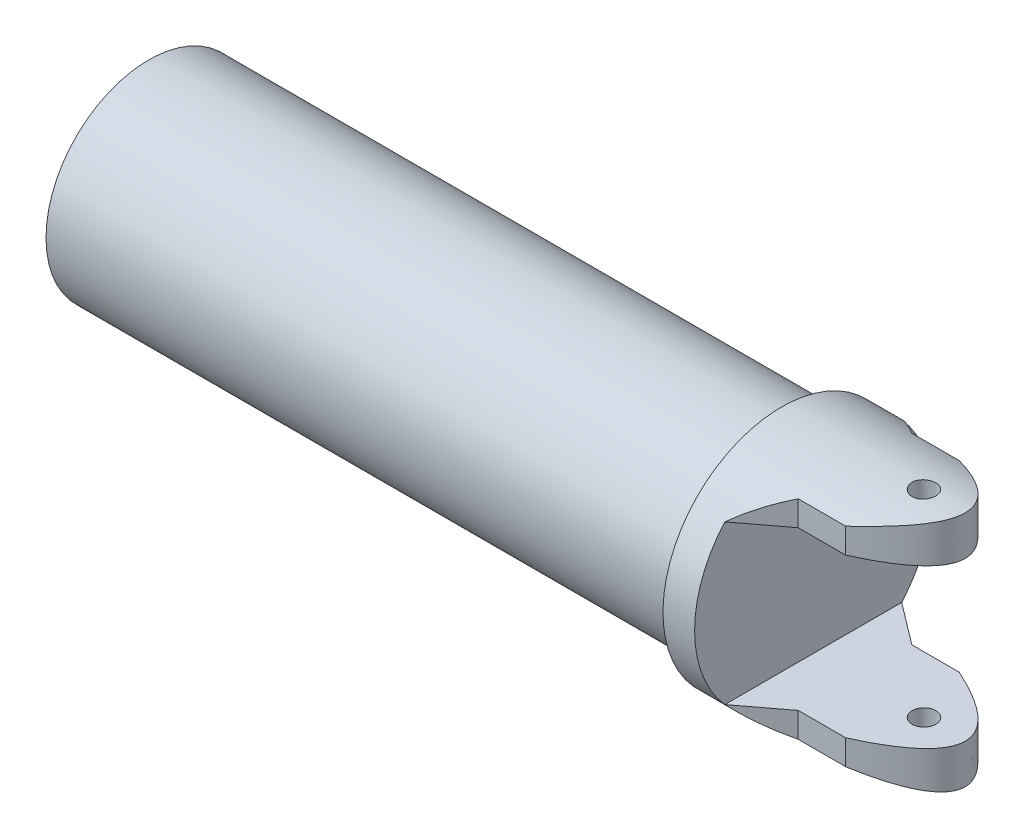
from build123d import *

# Parameters (mm, degrees)
SKETCH1_R               = 6.5
BOSS_EXTRUDE1_DEPTH     = 40
SKETCH2_R               = 7.5
BOSS_EXTRUDE2_DEPTH     = 2
BOSS_EXTRUDE3_DEPTH     = 10
CUT_EXTRUDE1_DEPTH      = 55.004629431
CUT_EXTRUDE1_DEPTH_BACK = 55.004629431
CUT_EXTRUDE2_DEPTH      = 54.619586107
CUT_EXTRUDE2_DEPTH_BACK = 54.619586107
SKETCH5_R               = 0.75
CUT_EXTRUDE3_DEPTH      = 30


with BuildPart() as part:
    # Sketch1 → Boss-Extrude1 (new body)
    with BuildSketch(Plane(origin=(0, 0, 0), x_dir=(0, 0, -1), z_dir=(1, 0, 0))):
        Circle(SKETCH1_R)
    extrude(amount=BOSS_EXTRUDE1_DEPTH)

    # Sketch2 → Boss-Extrude2 (add)
    with BuildSketch(Plane(origin=(40, 0, 0), x_dir=(0, 0, -1), z_dir=(1, 0, 0))):
        Circle(SKETCH2_R)
    extrude(amount=BOSS_EXTRUDE2_DEPTH)

    # Sketch3 → Boss-Extrude3 (add)
    with BuildSketch(Plane(origin=(42, 0, 0), x_dir=(0, 0, -1), z_dir=(1, 0, 0))):
        with BuildLine():
            ThreePointArc((5.590169944, 5), (0, 7.5), (-5.590169944, 5))
            Line((-5.590169944, 5), (-4.898979486, 5))
            Line((-4.898979486, 5), (4.898979486, 5))
            Line((4.898979486, 5), (5.590169944, 5))
        make_face()
        with BuildLine():
            Line((-4.898979486, -5), (-5.590169944, -5))
            ThreePointArc((-5.590169944, -5), (0, -7.5), (5.590169944, -5))
            Line((5.590169944, -5), (4.898979486, -5))
            Line((4.898979486, -5), (-4.898979486, -5))
        make_face()
    extrude(amount=BOSS_EXTRUDE3_DEPTH)

    # Sketch4 → Cut-Extrude1 (cut, two sides: drawn at the far end of the back side and taken through both)
    with BuildSketch(Plane.XZ.offset(-5).offset(-CUT_EXTRUDE1_DEPTH_BACK)):
        with BuildLine():
            Line((42, 5.590169944), (52, 5.590169944))
            Line((52, 5.590169944), (52, -5.590169944))
            Line((52, -5.590169944), (42, -5.590169944))
            Line((42, -5.590169944), (44.640400827, -3.590169944))
            Line((44.640400827, -3.590169944), (47.640400827, -3.590169944))
            add(Edge.make_bspline(
                [(47.640400827, -3.590169944), (50.280133609, -2.393446629), (52.919866391, 0), (50.280133609, 2.393446629), (47.640400827, 3.590169944)],
                knots=[0.178885438, 0.178885438, 0.178885438, 0.178885438, 0.5, 0.821114562, 0.821114562, 0.821114562, 0.821114562], degree=3))
            Line((47.640400827, 3.590169944), (44.640400827, 3.590169944))
            Line((44.640400827, 3.590169944), (42, 5.590169944))
        make_face()
    extrude(amount=CUT_EXTRUDE1_DEPTH + CUT_EXTRUDE1_DEPTH_BACK, mode=Mode.SUBTRACT)

    # Sketch5 → Cut-Extrude2 (cut, two sides: drawn at the far end of the back side and taken through both)
    with BuildSketch(Plane.XZ.offset(-5).offset(-CUT_EXTRUDE2_DEPTH_BACK)):
        with Locations(Location((49, 0, 0), (0, 0, 270))):
            Circle(SKETCH5_R)
    extrude(amount=CUT_EXTRUDE2_DEPTH + CUT_EXTRUDE2_DEPTH_BACK, mode=Mode.SUBTRACT)

    # Sketch6 → Cut-Extrude3 (cut)
    with BuildSketch(Plane.ZY):
        with BuildLine():
            Line((4, -0.5), (4.974937186, -0.5))
            ThreePointArc((4.974937186, -0.5), (3.535533906, -3.535533906), (0.5, -4.974937186))
            Line((0.5, -4.974937186), (0.5, -4))
            Line((0.5, -4), (-0.5, -4))
            Line((-0.5, -4), (-0.5, -4.974937186))
            ThreePointArc((-0.5, -4.974937186), (-3.535533906, -3.535533906), (-4.974937186, -0.5))
            Line((-4.974937186, -0.5), (-4, -0.5))
            Line((-4, -0.5), (-4, 0.5))
            Line((-4, 0.5), (-4.974937186, 0.5))
            ThreePointArc((-4.974937186, 0.5), (-3.535533906, 3.535533906), (-0.5, 4.974937186))
            Line((-0.5, 4.974937186), (-0.5, 4))
            Line((-0.5, 4), (0.5, 4))
            Line((0.5, 4), (0.5, 4.974937186))
            ThreePointArc((0.5, 4.974937186), (3.535533906, 3.535533906), (4.974937186, 0.5))
            Line((4.974937186, 0.5), (4, 0.5))
            Line((4, 0.5), (4, -0.5))
        make_face()
    extrude(amount=-CUT_EXTRUDE3_DEPTH, mode=Mode.SUBTRACT)


solid = part.part
